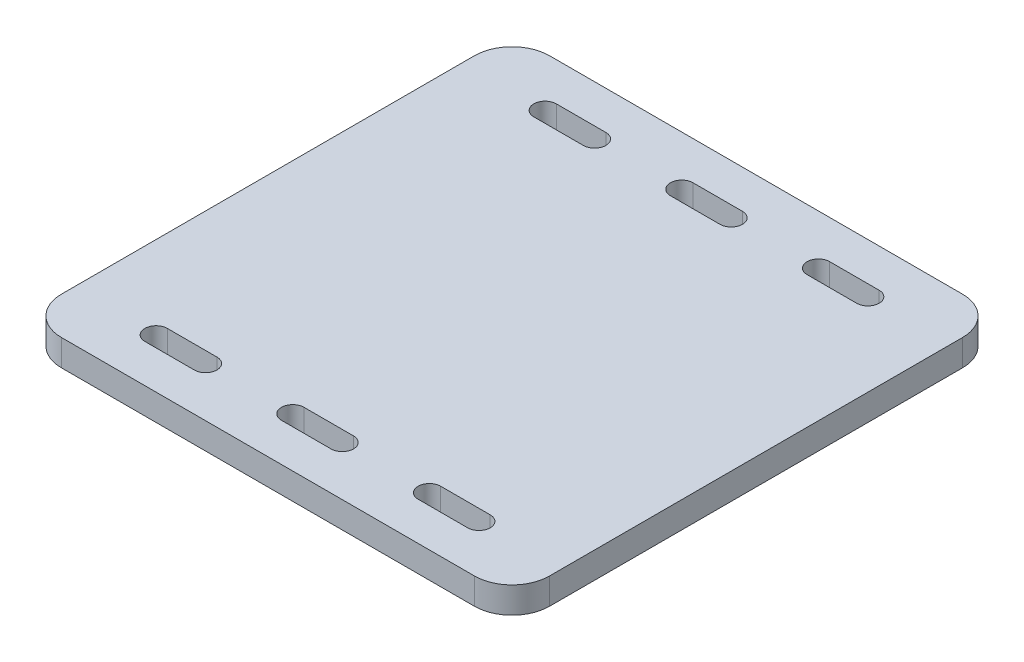
from build123d import *

# Parameters (mm, degrees)
BOSS_EXTRUDE1_DEPTH = 3.5


with BuildPart() as part:
    # Sketch1 → Boss-Extrude1 (new body)
    with BuildSketch(Plane(origin=(0, 0, 0), x_dir=(1, 0, 0), z_dir=(0, 1, 0))):
        with BuildLine():
            Line((-27.5, 32.5), (27.5, 32.5))
            ThreePointArc((27.5, 32.5), (31.035533906, 31.035533906), (32.5, 27.5))
            Line((32.5, 27.5), (32.5, -27.5))
            ThreePointArc((32.5, -27.5), (31.035533906, -31.035533906), (27.5, -32.5))
            Line((27.5, -32.5), (-27.5, -32.5))
            ThreePointArc((-27.5, -32.5), (-31.035533906, -31.035533906), (-32.5, -27.5))
            Line((-32.5, -27.5), (-32.5, 27.5))
            ThreePointArc((-32.5, 27.5), (-31.035533906, 31.035533906), (-27.5, 32.5))
        make_face()
        with BuildLine():
            Line((-21.5, -24.4), (-14.9, -24.4))
            ThreePointArc((-14.9, -24.4), (-13.4, -25.9), (-14.9, -27.4))
            Line((-14.9, -27.4), (-21.5, -27.4))
            ThreePointArc((-21.5, -27.4), (-23, -25.9), (-21.5, -24.4))
        make_face(mode=Mode.SUBTRACT)
        with BuildLine():
            Line((21.5, -27.4), (14.9, -27.4))
            ThreePointArc((14.9, -27.4), (13.4, -25.9), (14.9, -24.4))
            Line((14.9, -24.4), (21.5, -24.4))
            ThreePointArc((21.5, -24.4), (23, -25.9), (21.5, -27.4))
        make_face(mode=Mode.SUBTRACT)
        with BuildLine():
            Line((21.5, 24.4), (14.9, 24.4))
            ThreePointArc((14.9, 24.4), (13.4, 25.9), (14.9, 27.4))
            Line((14.9, 27.4), (21.5, 27.4))
            ThreePointArc((21.5, 27.4), (23, 25.9), (21.5, 24.4))
        make_face(mode=Mode.SUBTRACT)
        with BuildLine():
            Line((-21.5, 27.4), (-14.9, 27.4))
            ThreePointArc((-14.9, 27.4), (-13.4, 25.9), (-14.9, 24.4))
            Line((-14.9, 24.4), (-21.5, 24.4))
            ThreePointArc((-21.5, 24.4), (-23, 25.9), (-21.5, 27.4))
        make_face(mode=Mode.SUBTRACT)
        with BuildLine():
            Line((-3.3, -24.4), (3.3, -24.4))
            ThreePointArc((3.3, -24.4), (4.8, -25.9), (3.3, -27.4))
            Line((3.3, -27.4), (-3.3, -27.4))
            ThreePointArc((-3.3, -27.4), (-4.8, -25.9), (-3.3, -24.4))
        make_face(mode=Mode.SUBTRACT)
        with BuildLine():
            Line((-3.3, 27.4), (3.3, 27.4))
            ThreePointArc((3.3, 27.4), (4.8, 25.9), (3.3, 24.4))
            Line((3.3, 24.4), (-3.3, 24.4))
            ThreePointArc((-3.3, 24.4), (-4.8, 25.9), (-3.3, 27.4))
        make_face(mode=Mode.SUBTRACT)
    extrude(amount=BOSS_EXTRUDE1_DEPTH)


solid = part.part
